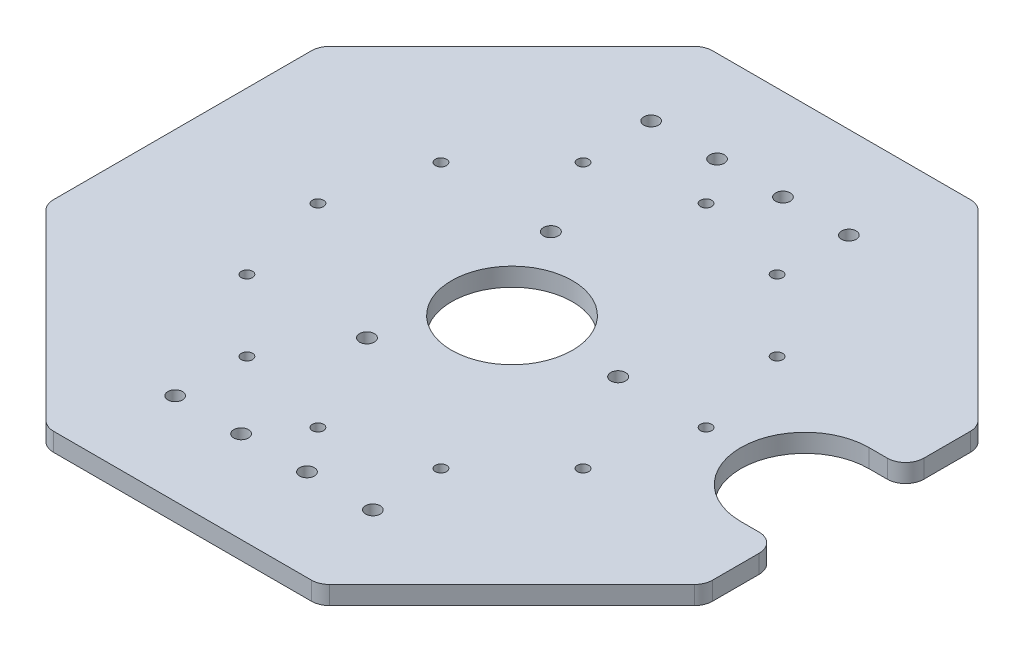
from build123d import *

# Parameters (mm, degrees)
SKETCH_1_R          = 16.5
SKETCH_1_R_2        = 2.025
SKETCH_1_R_3        = 1.525
EXTRUDE_1_DEPTH     = 5
SKETCH_2_R          = 5
CUT_EXTRUDE_1_DEPTH = 2
FILLET_1_R          = 5
SKETCH_3_R          = 2
CUT_EXTRUDE_2_DEPTH = 10


with BuildPart() as part:
    # 草图1 → 凸台-拉伸1 (new body)
    with BuildSketch(Plane(origin=(0, 0, 0), x_dir=(1, 0, 0), z_dir=(0, 1, 0))):
        with BuildLine():
            Line((-37.279220614, 90), (37.279220614, 90))
            Line((37.279220614, 90), (90, 37.279220614))
            Line((90, 37.279220614), (90, 17.5))
            Line((90, 17.5), (80, 17.5))
            ThreePointArc((80, 17.5), (62.5, 0), (80, -17.5))
            Line((80, -17.5), (90, -17.5))
            Line((90, -17.5), (90, -37.279220614))
            Line((90, -37.279220614), (37.279220614, -90))
            Line((37.279220614, -90), (-37.279220614, -90))
            Line((-37.279220614, -90), (-90, -37.279220614))
            Line((-90, -37.279220614), (-90, 37.279220614))
            Line((-90, 37.279220614), (-37.279220614, 90))
        make_face()
        with Locations(Location((0, 0, 0), (0, 0, 270))):
            Circle(SKETCH_1_R, mode=Mode.SUBTRACT)
        with Locations(Location((29, 0, 0), (0, 0, 270))):
            Circle(SKETCH_1_R_2, mode=Mode.SUBTRACT)
        with Locations(Location((-14.5, -25.11473671, 0), (0, 0, 270))):
            Circle(SKETCH_1_R_2, mode=Mode.SUBTRACT)
        with Locations(Location((-14.5, 25.11473671, 0), (0, 0, 270))):
            Circle(SKETCH_1_R_2, mode=Mode.SUBTRACT)
        with Locations(Location((0, 53, 0), (0, 0, 270))):
            Circle(SKETCH_1_R_3, mode=Mode.SUBTRACT)
        with Locations(Location((26.5, 45.899346401, 0), (0, 0, 270))):
            Circle(SKETCH_1_R_3, mode=Mode.SUBTRACT)
        with Locations(Location((45.899346401, 26.5, 0), (0, 0, 270))):
            Circle(SKETCH_1_R_3, mode=Mode.SUBTRACT)
        with Locations(Location((53, 0, 0), (0, 0, 270))):
            Circle(SKETCH_1_R_3, mode=Mode.SUBTRACT)
        with Locations(Location((45.899346401, -26.5, 0), (0, 0, 270))):
            Circle(SKETCH_1_R_3, mode=Mode.SUBTRACT)
        with Locations(Location((26.5, -45.899346401, 0), (0, 0, 270))):
            Circle(SKETCH_1_R_3, mode=Mode.SUBTRACT)
        with Locations(Location((0, -53, 0), (0, 0, 270))):
            Circle(SKETCH_1_R_3, mode=Mode.SUBTRACT)
        with Locations(Location((-26.5, -45.899346401, 0), (0, 0, 270))):
            Circle(SKETCH_1_R_3, mode=Mode.SUBTRACT)
        with Locations(Location((-45.899346401, -26.5, 0), (0, 0, 270))):
            Circle(SKETCH_1_R_3, mode=Mode.SUBTRACT)
        with Locations(Location((-53, 0, 0), (0, 0, 270))):
            Circle(SKETCH_1_R_3, mode=Mode.SUBTRACT)
        with Locations(Location((-45.899346401, 26.5, 0), (0, 0, 270))):
            Circle(SKETCH_1_R_3, mode=Mode.SUBTRACT)
        with Locations(Location((-26.5, 45.899346401, 0), (0, 0, 270))):
            Circle(SKETCH_1_R_3, mode=Mode.SUBTRACT)
    extrude(amount=EXTRUDE_1_DEPTH)

    # 草图2 → 切除-拉伸1 (cut)
    with BuildSketch(Plane.XZ):
        with Locations((19.25, 0)):
            Circle(SKETCH_2_R)
    extrude(amount=-CUT_EXTRUDE_1_DEPTH, mode=Mode.SUBTRACT)

    # 圆角1
    fillet_1_edges = [part.edges().sort_by_distance(p)[0] for p in [
        (16.047077922, 1, -3.839438782),
        (16.047077922, 1, 3.839438782),
        (-37.279220614, 2.5, -90),
        (37.279220614, 2.5, -90),
        (90, 2.5, -37.279220614),
        (90, 2.5, -17.5),
        (90, 2.5, 17.5),
        (90, 2.5, 37.279220614),
        (37.279220614, 2.5, 90),
        (-37.279220614, 2.5, 90),
        (-90, 2.5, 37.279220614),
        (-90, 2.5, -37.279220614),
    ]]
    fillet(fillet_1_edges, radius=FILLET_1_R)

    # 草图3 → 切除-拉伸2 (cut)
    with BuildSketch(Plane(origin=(0, 5, 0), x_dir=(1, 0, 0), z_dir=(0, 1, 0))):
        with Locations(Location((27, -65, 0), (0, 0, 270))):
            Circle(SKETCH_3_R)
        with Locations(Location((9, -65, 0), (0, 0, 270))):
            Circle(SKETCH_3_R)
        with Locations(Location((-27, -65, 0), (0, 0, 270))):
            Circle(SKETCH_3_R)
        with Locations(Location((-9, -65, 0), (0, 0, 270))):
            Circle(SKETCH_3_R)
        with Locations(Location((27, 65, 0), (0, 0, 270))):
            Circle(SKETCH_3_R)
        with Locations(Location((9, 65, 0), (0, 0, 270))):
            Circle(SKETCH_3_R)
        with Locations(Location((-9, 65, 0), (0, 0, 270))):
            Circle(SKETCH_3_R)
        with Locations(Location((-27, 65, 0), (0, 0, 270))):
            Circle(SKETCH_3_R)
    extrude(amount=-CUT_EXTRUDE_2_DEPTH, mode=Mode.SUBTRACT)


solid = part.part
